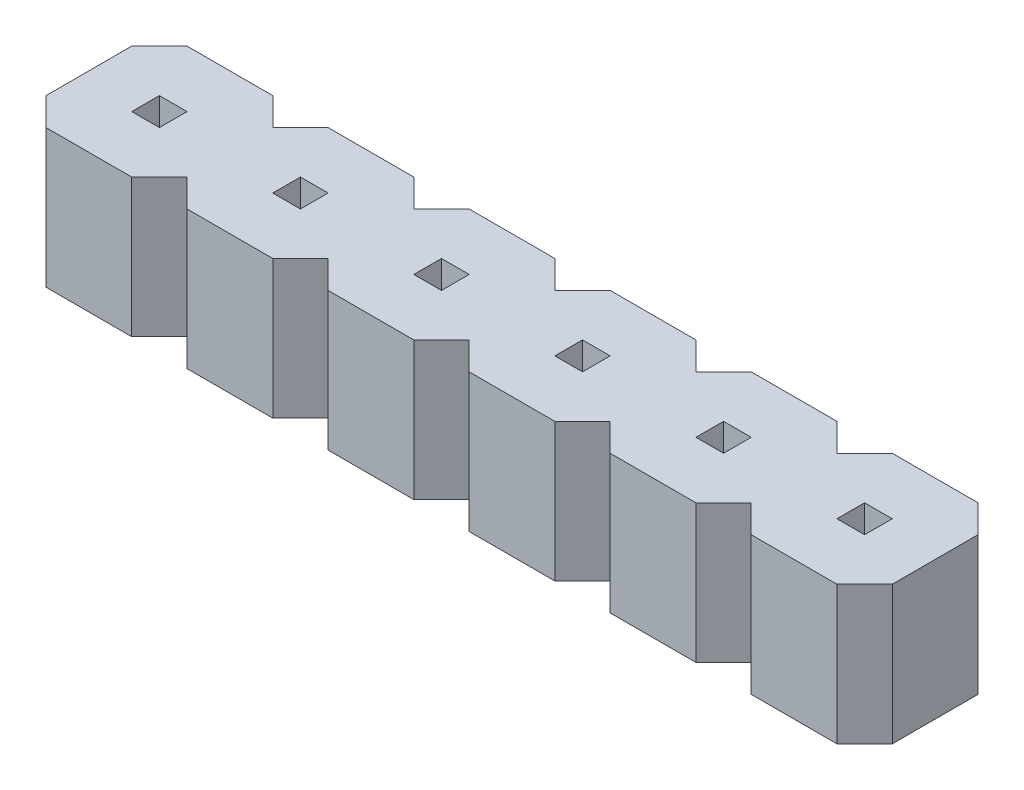
from build123d import *

# Parameters (mm, degrees)
BOSS_EXTRUDE1_DEPTH = 1.25
SKETCH2_W           = 0.5
SKETCH2_H           = 0.5
CUT_EXTRUDE1_DEPTH  = 15.303015416


with BuildPart() as part:
    # Sketch1 → Boss-Extrude1 (new, symmetric)
    with BuildSketch(Plane(origin=(0, 0, 0), x_dir=(1, 0, 0), z_dir=(0, 1, 0))):
        Polygon((-0.775, 1.275), (-1.275, 0.775), (-1.275, -0.775), (-0.775, -1.275), (0.775, -1.275), (1.275, -0.775), (1.775, -1.275), (3.325, -1.275), (3.825, -0.775), (4.325, -1.275), (5.875, -1.275), (6.375, -0.775), (6.875, -1.275), (8.425, -1.275), (8.925, -0.775), (9.425, -1.275), (10.975, -1.275), (11.475, -0.775), (11.975, -1.275), (13.525, -1.275), (14.025, -0.775), (14.025, 0.775), (13.525, 1.275), (11.975, 1.275), (11.475, 0.775), (10.975, 1.275), (9.425, 1.275), (8.925, 0.775), (8.425, 1.275), (6.875, 1.275), (6.375, 0.775), (5.875, 1.275), (4.325, 1.275), (3.825, 0.775), (3.325, 1.275), (1.775, 1.275), (1.275, 0.775), (0.775, 1.275), align=None)
    extrude(amount=BOSS_EXTRUDE1_DEPTH, both=True)

    # Sketch2 → Cut-Extrude1 (cut, through all)
    with BuildSketch(Plane(origin=(0, 1.25, 0), x_dir=(1, 0, 0), z_dir=(0, 1, 0))):
        with Locations((2.55, 0)):
            Rectangle(SKETCH2_W, SKETCH2_H)
        Rectangle(SKETCH2_W, SKETCH2_H)
        with Locations((5.1, 0)):
            Rectangle(SKETCH2_W, SKETCH2_H)
        with Locations((7.65, 0)):
            Rectangle(SKETCH2_W, SKETCH2_H)
        with Locations((10.2, 0)):
            Rectangle(SKETCH2_W, SKETCH2_H)
        with Locations((12.75, 0)):
            Rectangle(SKETCH2_W, SKETCH2_H)
    extrude(amount=-CUT_EXTRUDE1_DEPTH, mode=Mode.SUBTRACT)


solid = part.part
